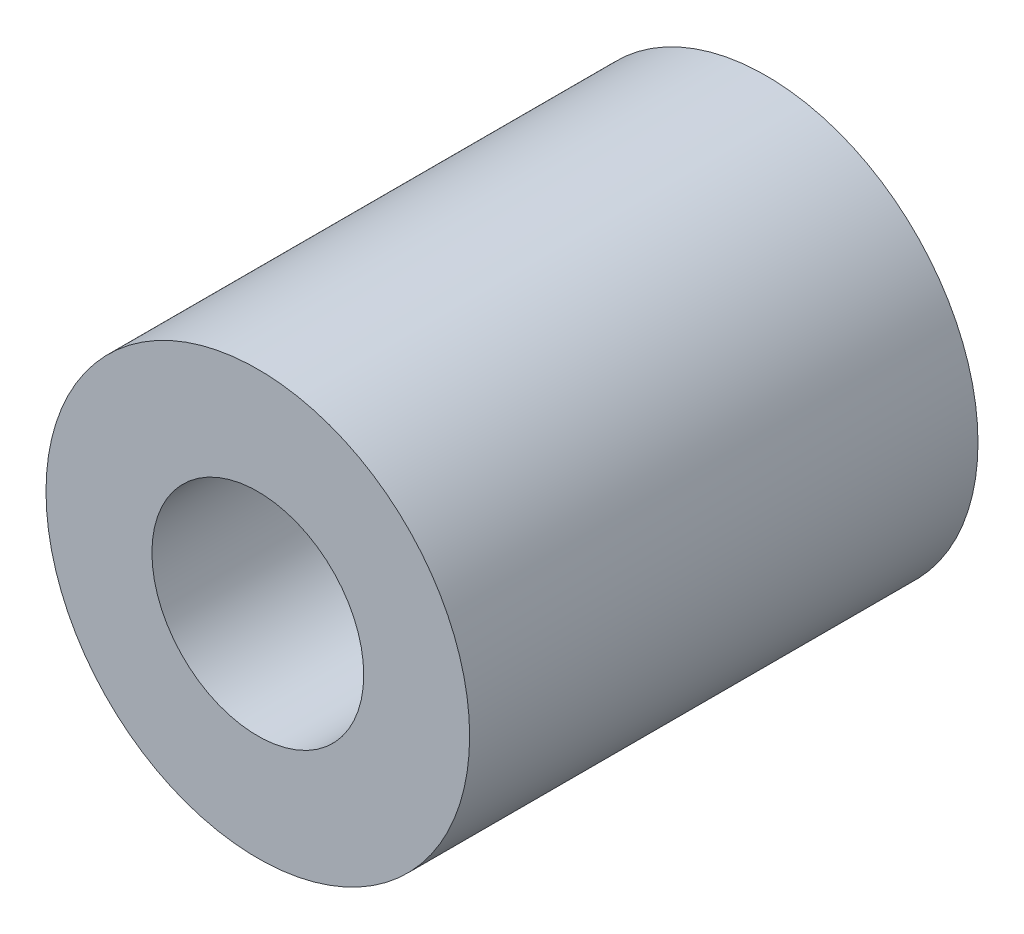
from build123d import *

# Parameters (mm, degrees)
SKETCH_2_R          = 2.5
EXTRUDE_1_DEPTH     = 6
M3X0_51_D           = 2.5
M3X0_51_CSINK_D     = 3.3
M3X0_51_CSINK_ANGLE = 90


with BuildPart() as part:
    # Эскиз2 → Бобышка-Вытянуть1 (new body)
    with BuildSketch(Plane.XY):
        with Locations((0, 1)):
            Circle(SKETCH_2_R)
    extrude(amount=EXTRUDE_1_DEPTH)

    # Отверстие обработанное метчиком M3x0.51 (through all)
    with Locations(Plane(origin=(0, 0, 0), x_dir=(1, 0, 0), z_dir=(0, 0, -1))):
        with Locations((0, -1)):
            CounterSinkHole(M3X0_51_D / 2, M3X0_51_CSINK_D / 2, counter_sink_angle=M3X0_51_CSINK_ANGLE)


solid = part.part
